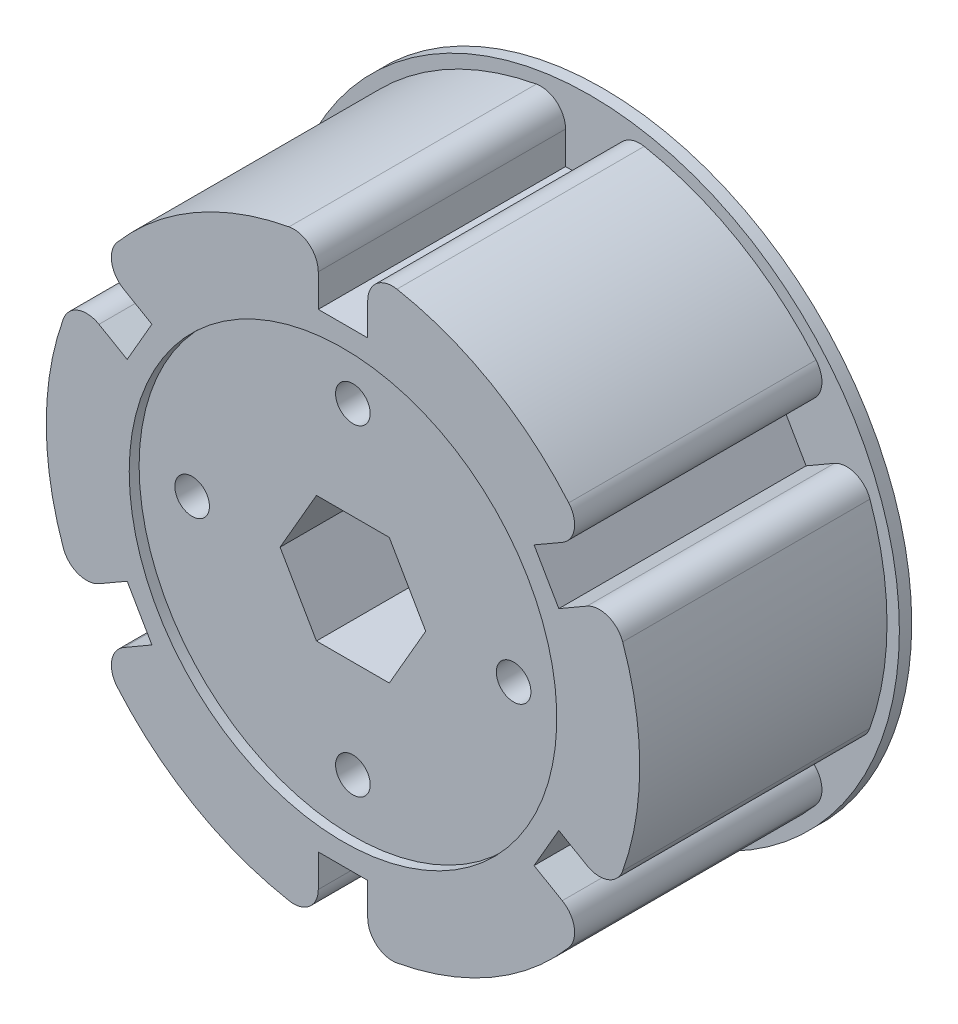
from build123d import *

# Parameters (mm, degrees)
SKETCH1_R                = 30.48
BOSS_EXTRUDE1_DEPTH      = 12.7
SKETCH2_R                = 31.75
BOSS_EXTRUDE2_DEPTH      = 1.27
SKETCH3_W                = 5.08
SKETCH3_H                = 7.62
CUT_EXTRUDE1_DEPTH       = 52.587643869
FILLET1_R                = 2.54
CIRPATTERN1_COUNT        = 6
FILLET1_OF_CIRPATTERN1_R = 2.54
CUT_EXTRUDE4_DEPTH       = 53.224648395
CUT_EXTRUDE4_DEPTH_BACK  = 53.224648395
CUT_EXTRUDE5_DEPTH       = 53.224648395
CUT_EXTRUDE5_DEPTH_BACK  = 53.224648395
SKETCH7_R                = 1.778
SKETCH8_R                = 21.95890497
CUT_EXTRUDE6_DEPTH       = 1.016


with BuildPart() as part:
    # Sketch1 → Boss-Extrude1 (new, symmetric)
    with BuildSketch(Plane.XY):
        Circle(SKETCH1_R)
    extrude(amount=BOSS_EXTRUDE1_DEPTH, both=True)

    # Sketch2 → Boss-Extrude2 (add)
    with BuildSketch(Plane.XY.offset(-12.7)):
        Circle(SKETCH2_R)
    extrude(amount=-BOSS_EXTRUDE2_DEPTH)

    # Sketch3 → Cut-Extrude1 (cut, through all)
    with BuildSketch(Plane.XY.offset(-12.7)):
        with Locations((0, 27.94)):
            Rectangle(SKETCH3_W, SKETCH3_H)
    cut_extrude1 = extrude(amount=CUT_EXTRUDE1_DEPTH, mode=Mode.SUBTRACT)

    # Fillet1
    fillet1_edges = [part.edges().sort_by_distance(p)[0] for p in [
        (2.54, 30.373982287, 0),
        (-2.54, 30.373982287, 0),
    ]]
    fillet(fillet1_edges, radius=FILLET1_R)

    # CirPattern1: Cut-Extrude1 ×6 about axis
    cirpattern1_axis = Axis((0, 0, 20.0025), (0, 0, -1))
    for i in range(1, CIRPATTERN1_COUNT):
        add(cut_extrude1.rotate(cirpattern1_axis, i * 360 / CIRPATTERN1_COUNT), mode=Mode.SUBTRACT)

    # Fillet1 of CirPattern1
    fillet1_of_cirpattern1_edges = [part.edges().sort_by_distance(p)[0] for p in [
        (27.574640275, 12.987286618, 0),
        (25.034640275, 17.386695669, 0),
        (25.034640275, -17.386695669, 0),
        (27.574640275, -12.987286618, 0),
        (-2.54, -30.373982287, 0),
        (2.54, -30.373982287, 0),
        (-27.574640275, -12.987286618, 0),
        (-25.034640275, -17.386695669, 0),
        (-25.034640275, 17.386695669, 0),
        (-27.574640275, 12.987286618, 0),
    ]]
    fillet(fillet1_of_cirpattern1_edges, radius=FILLET1_OF_CIRPATTERN1_R)

    # Sketch6 → Cut-Extrude4 (cut, two sides: drawn at the far end of the back side and taken through both)
    with BuildSketch(Plane(origin=(0, 0, -13.97), x_dir=(-1, 0, 0), z_dir=(0, 0, -1)).offset(-CUT_EXTRUDE4_DEPTH_BACK)):
        Polygon((-3.739497694, 6.477), (-7.478995387, 0), (-3.739497694, -6.477), (3.739497694, -6.477), (7.478995387, 0), (3.739497694, 6.477), align=None)
    extrude(amount=CUT_EXTRUDE4_DEPTH + CUT_EXTRUDE4_DEPTH_BACK, mode=Mode.SUBTRACT)

    # Sketch7 → Cut-Extrude5 (cut, two sides: drawn at the far end of the back side and taken through both)
    with BuildSketch(Plane(origin=(0, 0, -13.97), x_dir=(-1, 0, 0), z_dir=(0, 0, -1)).offset(-CUT_EXTRUDE5_DEPTH_BACK)):
        with Locations((-16.51, 0)):
            Circle(SKETCH7_R)
        with Locations((0, 16.51)):
            Circle(SKETCH7_R)
        with Locations((16.51, 0)):
            Circle(SKETCH7_R)
        with Locations((0, -16.51)):
            Circle(SKETCH7_R)
    extrude(amount=CUT_EXTRUDE5_DEPTH + CUT_EXTRUDE5_DEPTH_BACK, mode=Mode.SUBTRACT)

    # Sketch8 → Cut-Extrude6 (cut)
    with BuildSketch(Plane(origin=(0, 0, 12.7), x_dir=(-1, 0, 0), z_dir=(0, 0, -1))):
        Circle(SKETCH8_R)
    extrude(amount=CUT_EXTRUDE6_DEPTH, mode=Mode.SUBTRACT)


solid = part.part
